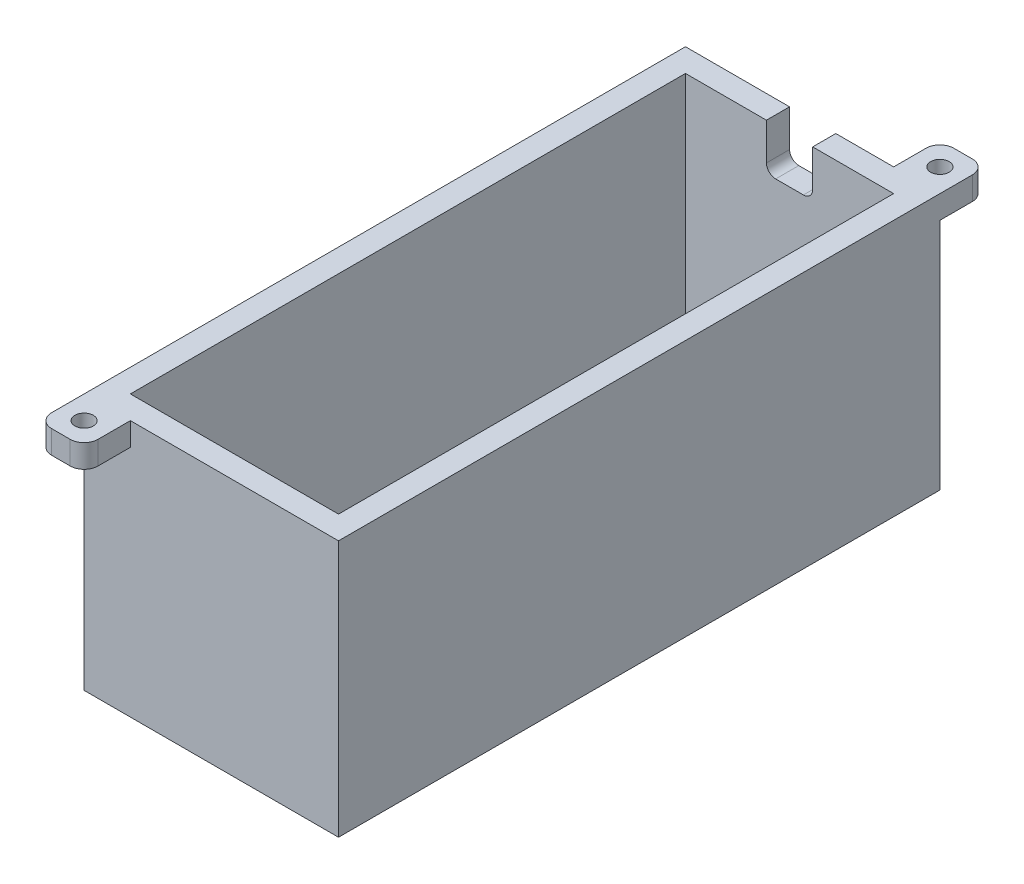
from build123d import *

# Parameters (mm, degrees)
SKETCH1_W           = 27.5
SKETCH1_H           = 65
BOSS_EXTRUDE1_DEPTH = 5
SKETCH2_W           = 55
SKETCH2_H           = 130
SKETCH2_W_2         = 45
SKETCH2_H_2         = 120
BOSS_EXTRUDE2_DEPTH = 50.5
SKETCH3_W           = 10
SKETCH3_H           = 10
BOSS_EXTRUDE4_DEPTH = 5
SKETCH4_R           = 2
CUT_EXTRUDE1_DEPTH  = 5
FILLET1_R           = 1
FILLET2_R           = 1
SKETCH6_W           = 38
SKETCH6_H           = 45.3
CUT_EXTRUDE2_DEPTH  = 5
FILLET3_R           = 3
CUT_EXTRUDE3_DEPTH  = 5
FILLET4_R           = 2


with BuildPart() as part:
    # Sketch1 → Boss-Extrude1 (new body)
    with BuildSketch(Plane(origin=(0, 0, 0), x_dir=(1, 0, 0), z_dir=(0, 1, 0))):
        Polygon((27.5, 0), (0, 0), (0, 65), (-27.5, 65), (-27.5, -65), (27.5, -65), align=None)
        with Locations((13.75, 32.5)):
            Rectangle(SKETCH1_W, SKETCH1_H)
    extrude(amount=BOSS_EXTRUDE1_DEPTH)

    # Sketch2 → Boss-Extrude2 (add)
    with BuildSketch(Plane(origin=(0, 5, 0), x_dir=(1, 0, 0), z_dir=(0, 1, 0))):
        Rectangle(SKETCH2_W, SKETCH2_H)
        Rectangle(SKETCH2_W_2, SKETCH2_H_2, mode=Mode.SUBTRACT)
    extrude(amount=BOSS_EXTRUDE2_DEPTH)

    # Sketch3 → Boss-Extrude4 (add)
    with BuildSketch(Plane(origin=(0, 55.5, 0), x_dir=(1, 0, 0), z_dir=(0, 1, 0))):
        with Locations((22.5, 70)):
            Rectangle(SKETCH3_W, SKETCH3_H)
        with Locations((-22.5, -70)):
            Rectangle(SKETCH3_W, SKETCH3_H)
    extrude(amount=-BOSS_EXTRUDE4_DEPTH)

    # Sketch4 → Cut-Extrude1 (cut)
    with BuildSketch(Plane.XZ.offset(-50.5)):
        with Locations(Location((22.5, -70, 0), (0, 0, 270))):
            Circle(SKETCH4_R)
        with Locations(Location((-22.5, 70, 0), (0, 0, 270))):
            Circle(SKETCH4_R)
    extrude(amount=-CUT_EXTRUDE1_DEPTH, mode=Mode.SUBTRACT)

    # Fillet1
    fillet1_edges = [part.edges().sort_by_distance(p)[0] for p in [
        (22.5, 50.5, -68),
    ]]
    fillet(fillet1_edges, radius=FILLET1_R)

    # Fillet2
    fillet2_edges = [part.edges().sort_by_distance(p)[0] for p in [
        (-22.5, 50.5, 72),
    ]]
    fillet(fillet2_edges, radius=FILLET2_R)

    # Sketch6 → Cut-Extrude2 (cut)
    with BuildSketch(Plane.XZ):
        Rectangle(SKETCH6_W, SKETCH6_H)
    extrude(amount=-CUT_EXTRUDE2_DEPTH, mode=Mode.SUBTRACT)

    # Fillet3
    fillet3_edges = [part.edges().sort_by_distance(p)[0] for p in [
        (17.5, 53, -75),
        (27.5, 53, -75),
        (-17.5, 53, 75),
        (-27.5, 53, 75),
    ]]
    fillet(fillet3_edges, radius=FILLET3_R)

    # Sketch8 → Cut-Extrude3 (cut)
    with BuildSketch(Plane(origin=(0, 0, -65), x_dir=(-1, 0, 0), z_dir=(0, 0, -1))):
        Polygon((0, 55.5), (5, 55.5), (5, 45.5), (-5, 45.5), (-5, 55.5), align=None)
    extrude(amount=-CUT_EXTRUDE3_DEPTH, mode=Mode.SUBTRACT)

    # Fillet4
    fillet4_edges = [part.edges().sort_by_distance(p)[0] for p in [
        (-5, 45.5, -62.5),
        (5, 45.5, -62.5),
    ]]
    fillet(fillet4_edges, radius=FILLET4_R)


solid = part.part
